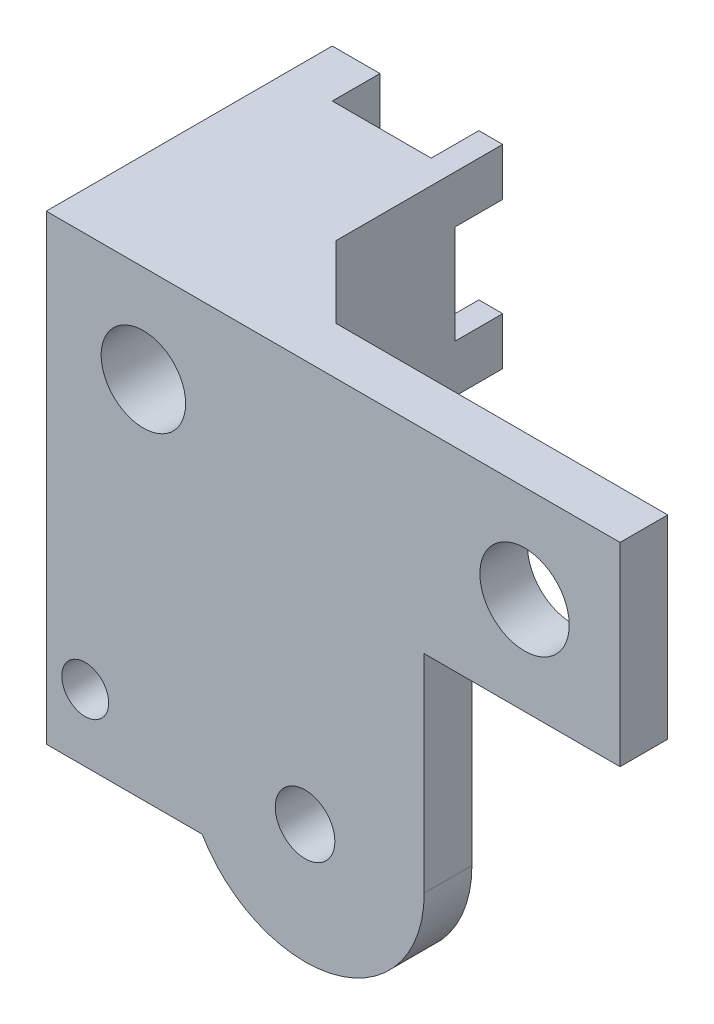
from build123d import *

# Parameters (mm, degrees)
BOSS_EXTRUDE1_DEPTH  = 20.701
SKETCH2_R            = 1
CUT_EXTRUDE1_DEPTH   = 93.545558787
SKETCH3_R            = 1
CUT_EXTRUDE2_DEPTH   = 12.7
SKETCH4_R            = 1
BOSS_EXTRUDE3_DEPTH  = 5.08
SKETCH5_W            = 5.08
SKETCH5_H            = 5.08
BOSS_EXTRUDE4_DEPTH  = 5.08
SKETCH6_W            = 5.08
SKETCH6_H            = 5.08
BOSS_EXTRUDE5_DEPTH  = 5.08
SKETCH7_W            = 2.54
SKETCH7_H            = 15
CUT_EXTRUDE3_DEPTH   = 108.238791728
SKETCH8_W            = 25.4
SKETCH8_H            = 32.87751569
CUT_EXTRUDE4_DEPTH   = 99.137252123
BOSS_EXTRUDE6_DEPTH  = 5.08
BOSS_EXTRUDE9_START  = -5.08
SKETCH12_R           = 1
BOSS_EXTRUDE9_DEPTH  = 5.08
SKETCH13_R           = 1
BOSS_EXTRUDE10_DEPTH = 24.4
CUT_EXTRUDE5_DEPTH   = 30
SKETCH11_R           = 4.5
CUT_EXTRUDE6_DEPTH   = 40
SKETCH16_R           = 3.175
SKETCH16_R_2         = 4.7625
SKETCH16_R_3         = 2.5
CUT_EXTRUDE7_DEPTH   = 40


with BuildPart() as part:
    # Sketch1 → Boss-Extrude1 (new body)
    with BuildSketch(Plane(origin=(0, 0, 0), x_dir=(1, 0, 0), z_dir=(0, 1, 0))):
        Polygon((86.5505, 0), (86.5505, 25.4), (81.4705, 25.4), (81.4705, 10.16), (76.3905, 5.08), (81.4705, 5.08), (81.4705, 0), align=None)
        Polygon((20.701, 10.16), (20.701, 25.4), (0, 25.4), (0, 0), (81.4705, 0), (81.4705, 5.08), (76.3905, 5.08), (25.781, 5.08), (20.701, 5.08), align=None)
        Polygon((20.701, 10.16), (25.781, 5.08), (20.701, 5.08), align=None)
    extrude(amount=BOSS_EXTRUDE1_DEPTH)

    # Sketch2 → Cut-Extrude1 (cut, through all)
    with BuildSketch(Plane(origin=(0, 0, -25.4), x_dir=(-1, 0, 0), z_dir=(0, 0, -1))):
        with Locations((-10.3505, 10.3505)):
            Circle(SKETCH2_R)
    extrude(amount=-CUT_EXTRUDE1_DEPTH, mode=Mode.SUBTRACT)

    # Sketch3 → Cut-Extrude2 (cut)
    with BuildSketch(Plane.XY):
        with Locations((50.970999912, 10.3505)):
            Circle(SKETCH3_R)
    extrude(amount=-CUT_EXTRUDE2_DEPTH, mode=Mode.SUBTRACT)

    # Sketch4 → Boss-Extrude3 (add)
    with BuildSketch(Plane.XY):
        with BuildLine():
            Line((40.280941282, 0), (27.580941282, 0))
            Line((27.580941282, 0), (25.4, 0))
            Line((25.4, 0), (0, 0))
            Line((0, 0), (16.608872552, -28.493600659))
            ThreePointArc((16.608872552, -28.493600659), (30.893397103, -34.358409309), (40.280941282, -22.098))
            Line((40.280941282, -22.098), (40.280941282, 0))
        make_face()
        with Locations((20.138741282, -22.098)):
            Circle(SKETCH4_R, mode=Mode.SUBTRACT)
        with BuildLine():
            ThreePointArc((26.580941282, -22.098), (26.873834501, -21.390893219), (27.580941282, -21.098))
            ThreePointArc((27.580941282, -21.098), (28.288048063, -21.390893219), (28.580941282, -22.098))
            ThreePointArc((28.580941282, -22.098), (27.580941282, -23.098), (26.580941282, -22.098))
        make_face(mode=Mode.SUBTRACT)
        with BuildLine():
            ThreePointArc((36.023141282, -22.098), (35.023141282, -23.098), (34.023141282, -22.098))
            ThreePointArc((34.023141282, -22.098), (35.023141282, -21.098), (36.023141282, -22.098))
        make_face(mode=Mode.SUBTRACT)
    extrude(amount=-BOSS_EXTRUDE3_DEPTH)

    # Sketch5 → Boss-Extrude4 (add)
    with BuildSketch(Plane(origin=(0, 0, -25.4), x_dir=(-1, 0, 0), z_dir=(0, 0, -1))):
        with Locations((-2.54, 2.54)):
            Rectangle(SKETCH5_W, SKETCH5_H)
        with Locations((-2.54, 18.161)):
            Rectangle(SKETCH5_W, SKETCH5_H)
        with Locations((-18.161, 18.161)):
            Rectangle(SKETCH5_W, SKETCH5_H)
        with Locations((-18.161, 2.54)):
            Rectangle(SKETCH5_W, SKETCH5_H)
    extrude(amount=BOSS_EXTRUDE4_DEPTH)

    # Sketch6 → Boss-Extrude5 (add)
    with BuildSketch(Plane(origin=(0, 0, -25.4), x_dir=(-1, 0, 0), z_dir=(0, 0, -1))):
        with Locations((-84.0105, 18.161)):
            Rectangle(SKETCH6_W, SKETCH6_H)
        with Locations((-84.0105, 2.54)):
            Rectangle(SKETCH6_W, SKETCH6_H)
    extrude(amount=BOSS_EXTRUDE5_DEPTH)

    # Sketch7 → Cut-Extrude3 (cut, through all)
    with BuildSketch(Plane(origin=(0, 20.701, 0), x_dir=(1, 0, 0), z_dir=(0, 1, 0))):
        with Locations((82.7405, 22.98)):
            Rectangle(SKETCH7_W, SKETCH7_H)
        with Locations((19.431, 22.98)):
            Rectangle(SKETCH7_W, SKETCH7_H)
    extrude(amount=-CUT_EXTRUDE3_DEPTH, mode=Mode.SUBTRACT)

    # Sketch8 → Cut-Extrude4 (cut, through all)
    with BuildSketch(Plane(origin=(0, 0, 0), x_dir=(-1, 0, 0), z_dir=(0, -1, 0))):
        with Locations((-73.8505, 16.438757845)):
            Rectangle(SKETCH8_W, SKETCH8_H)
    extrude(amount=-CUT_EXTRUDE4_DEPTH, mode=Mode.SUBTRACT)

    # Sketch9 → Boss-Extrude6 (add)
    with BuildSketch(Plane.XY):
        with BuildLine():
            Line((8.304436276, -28.493600659), (16.608872552, -28.493600659))
            Line((16.608872552, -28.493600659), (0, 0))
            Line((0, 0), (0, -14.24680033))
            Line((0, -14.24680033), (3.648627535, -20.506258075))
            ThreePointArc((3.648627535, -20.506258075), (4.650419602, -20.503139192), (5.152218138, -21.370200495))
            ThreePointArc((5.152218138, -21.370200495), (5.01927944, -21.868401958), (4.655808741, -22.234142914))
            Line((4.655808741, -22.234142914), (8.304436276, -28.493600659))
        make_face()
        with BuildLine():
            Line((0, -28.493600659), (8.304436276, -28.493600659))
            Line((8.304436276, -28.493600659), (4.655808741, -22.234142914))
            ThreePointArc((4.655808741, -22.234142914), (3.288275718, -21.873791098), (3.648627535, -20.506258075))
            Line((3.648627535, -20.506258075), (0, -14.24680033))
            Line((0, -14.24680033), (0, -28.493600659))
        make_face()
    extrude(amount=-BOSS_EXTRUDE6_DEPTH)

    # Sketch12 → Boss-Extrude9 (add)
    with BuildSketch(Plane(origin=(0, 0, -5.08), x_dir=(-1, 0, 0), z_dir=(0, 0, -1)).offset(BOSS_EXTRUDE9_START)):
        with Locations((-4.152218138, -21.370200495)):
            Circle(SKETCH12_R)
        with Locations((-20.138741282, -22.098)):
            Circle(SKETCH12_R)
        with Locations((-27.580941282, -22.098)):
            Circle(SKETCH12_R)
        with Locations((-35.023141282, -22.098)):
            Circle(SKETCH12_R)
        with Locations((-50.970999912, 10.3505)):
            Circle(SKETCH12_R)
    extrude(amount=BOSS_EXTRUDE9_DEPTH)

    # Sketch13 → Boss-Extrude10 (add)
    with BuildSketch(Plane(origin=(0, 0, -25.4), x_dir=(-1, 0, 0), z_dir=(0, 0, -1))):
        with Locations((-10.3505, 10.3505)):
            Circle(SKETCH13_R)
    extrude(amount=-BOSS_EXTRUDE10_DEPTH)

    # Sketch15 → Cut-Extrude5 (cut)
    with BuildSketch(Plane(origin=(0, 20.701, 0), x_dir=(1, 0, 0), z_dir=(0, 1, 0))):
        Polygon((18.161, 15.48), (18.161, 12.717664049), (20.701, 10.16), (20.701, 15.48), align=None)
    extrude(amount=-CUT_EXTRUDE5_DEPTH, mode=Mode.SUBTRACT)

    # Sketch11 → Cut-Extrude6 (cut)
    with BuildSketch(Plane.XY):
        with Locations((10.3505, 10.3505)):
            Circle(SKETCH11_R)
    extrude(amount=-CUT_EXTRUDE6_DEPTH, mode=Mode.SUBTRACT)

    # Sketch16 → Cut-Extrude7 (cut)
    with BuildSketch(Plane.XY):
        with Locations((27.580941282, -22.098)):
            Circle(SKETCH16_R)
        with Locations((50.970999912, 10.3505)):
            Circle(SKETCH16_R_2)
        with Locations((4.152218138, -21.370200495)):
            Circle(SKETCH16_R_3)
    extrude(amount=-CUT_EXTRUDE7_DEPTH, mode=Mode.SUBTRACT)


solid = part.part
